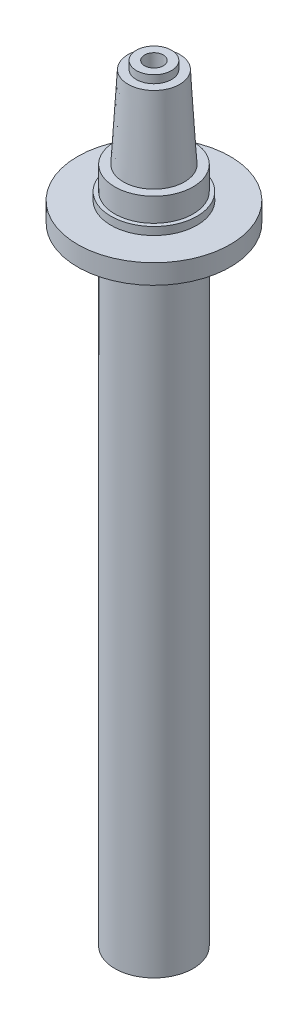
from build123d import *

# Parameters (mm, degrees)
SKETCH2_R           = 5.5
BOSS_EXTRUDE1_DEPTH = 1


with BuildPart() as part:
    # Sketch1 → Revolve1 (revolve)
    with BuildSketch(Plane.XY, mode=Mode.PRIVATE) as revolve1_sk:
        Polygon((0, 0), (5, 0), (5, 80), (9.75, 80), (9.75, 82.5), (5, 82.5), (5, 86.5), (3.9, 86.5), (3.3, 97), (2.25, 97), (2.25, 98), (1.2, 98), (1.2, 92), (0, 92), align=None)
    revolve(revolve1_sk.sketch.rotate(Axis((0, 92, 0), (0, -1, 0)), 180), axis=Axis((0, 92, 0), (0, -1, 0)))

    # Sketch2 → Boss-Extrude1 (add)
    with BuildSketch(Plane(origin=(0, 82.5, 0), x_dir=(1, 0, 0), z_dir=(0, 1, 0))):
        Circle(SKETCH2_R)
    extrude(amount=BOSS_EXTRUDE1_DEPTH)


solid = part.part
